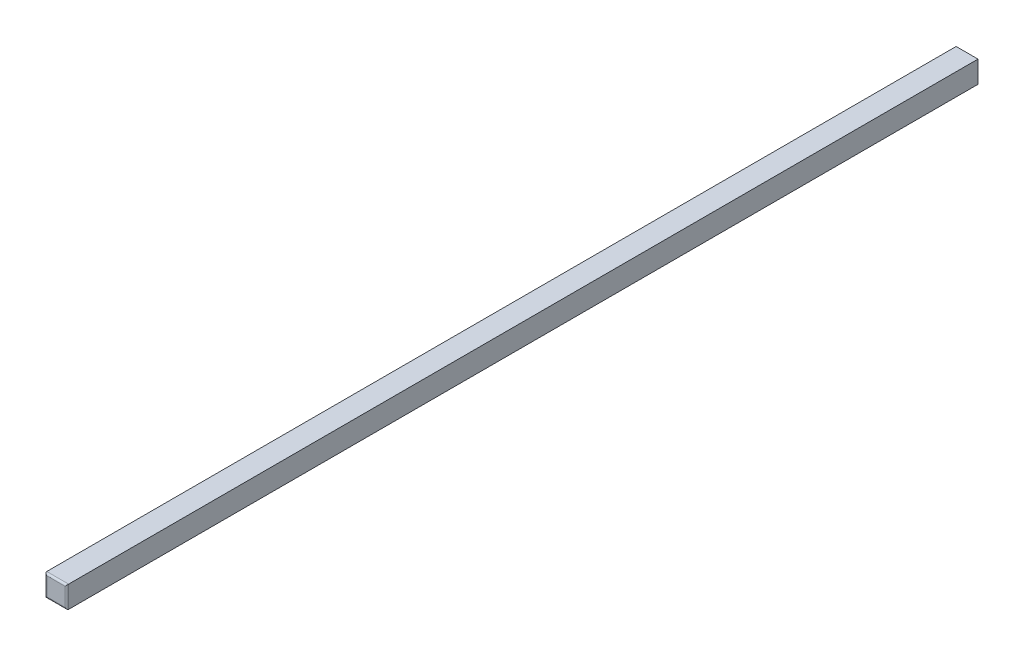
from build123d import *

# Parameters (mm, degrees)
SKETCH3_W           = 6
SKETCH3_H           = 6
BOSS_EXTRUDE1_DEPTH = 125
FILLET1_R           = 0.5


with BuildPart() as part:
    # Sketch3 → Boss-Extrude1 (new, symmetric)
    with BuildSketch(Plane.XY):
        Rectangle(SKETCH3_W, SKETCH3_H)
    extrude(amount=BOSS_EXTRUDE1_DEPTH, both=True)

    # Fillet1
    fillet1_edges = [part.edges().sort_by_distance(p)[0] for p in [
        (3, 0, 125),
        (0, 3, 125),
        (-3, 0, 125),
        (0, -3, 125),
    ]]
    fillet(fillet1_edges, radius=FILLET1_R)


solid = part.part
